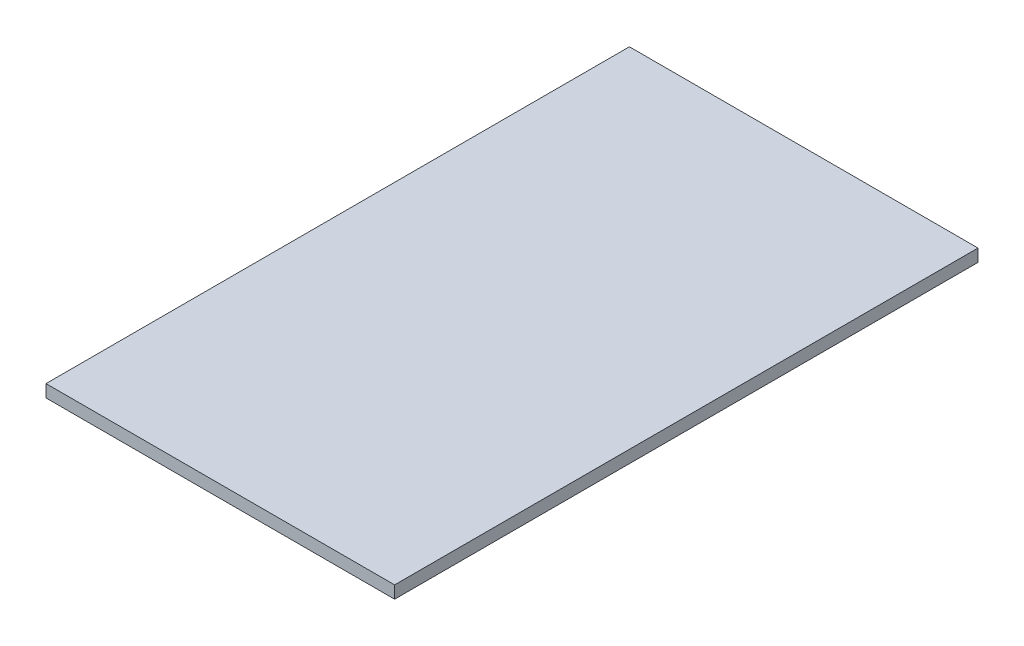
from build123d import *

# Parameters (mm, degrees)
SKETCH1_W           = 98
SKETCH1_H           = 164
MAIN_BODY_DEPTH     = 3.5
SKETCH2_W           = 74
SKETCH2_H           = 40
PCBS_AND_SUCH_DEPTH = 5


with BuildPart() as part:
    # Sketch1 → MAIN BODY (new body)
    with BuildSketch(Plane(origin=(0, 0, 0), x_dir=(1, 0, 0), z_dir=(0, 1, 0))):
        Rectangle(SKETCH1_W, SKETCH1_H)
    extrude(amount=MAIN_BODY_DEPTH)

    # Sketch2 → PCBs AND SUCH (add)
    with BuildSketch(Plane.XZ):
        with Locations((-12, -62)):
            Rectangle(SKETCH2_W, SKETCH2_H)
    extrude(amount=PCBS_AND_SUCH_DEPTH)


solid = part.part
